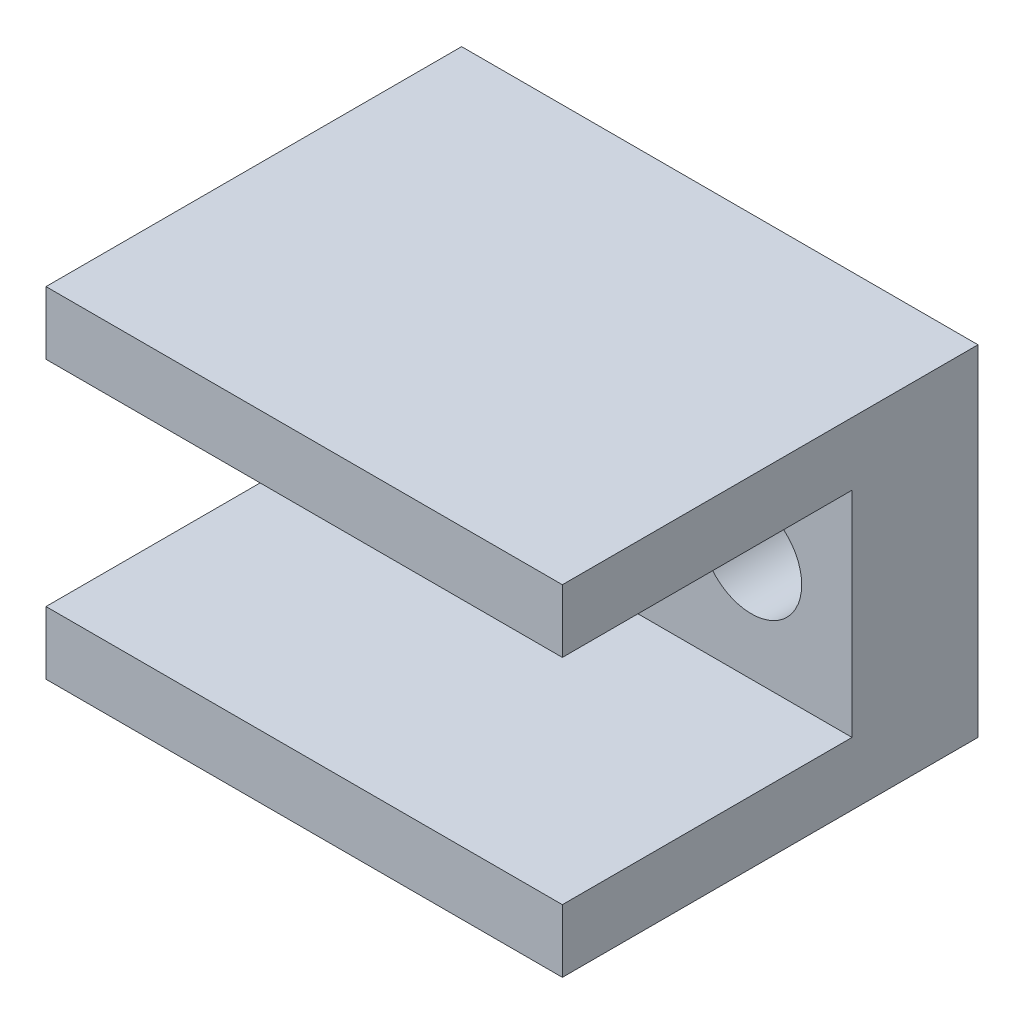
from build123d import *

# Parameters (mm, degrees)
SKETCH1_W           = 41
SKETCH1_H           = 27
BOSS_EXTRUDE1_DEPTH = 10
SKETCH2_W           = 41
SKETCH2_H           = 5
BOSS_EXTRUDE2_DEPTH = 23
CUT_EXTRUDE1_REACH  = 35.638
SKETCH3_R           = 4


with BuildPart() as part:
    # Sketch1 → Boss-Extrude1 (new body)
    with BuildSketch(Plane.XY):
        Rectangle(SKETCH1_W, SKETCH1_H)
    extrude(amount=BOSS_EXTRUDE1_DEPTH)

    # Sketch2 → Boss-Extrude2 (add)
    with BuildSketch(Plane.XY.offset(10)):
        with Locations((0, 11)):
            Rectangle(SKETCH2_W, SKETCH2_H)
        with Locations((0, -11)):
            Rectangle(SKETCH2_W, SKETCH2_H)
    extrude(amount=BOSS_EXTRUDE2_DEPTH)

    # Sketch3 → Cut-Extrude1 (cut, up to next)
    with BuildSketch(Plane.XY.offset(10), mode=Mode.PRIVATE) as cut_extrude1_sk1:
        with Locations((-12.5, 0)):
            Circle(SKETCH3_R)
    cut_extrude1_tool1 = extrude(cut_extrude1_sk1.sketch, amount=-CUT_EXTRUDE1_REACH, mode=Mode.PRIVATE) & part.part
    # Sketch3 → Cut-Extrude1 (cut, up to next)
    with BuildSketch(Plane.XY.offset(10), mode=Mode.PRIVATE) as cut_extrude1_sk2:
        with Locations((12.5, 0)):
            Circle(SKETCH3_R)
    cut_extrude1_tool2 = extrude(cut_extrude1_sk2.sketch, amount=-CUT_EXTRUDE1_REACH, mode=Mode.PRIVATE) & part.part
    add(cut_extrude1_tool1.solids().sort_by_distance((-12.5, 0, 10))[0], mode=Mode.SUBTRACT)
    add(cut_extrude1_tool2.solids().sort_by_distance((12.5, 0, 10))[0], mode=Mode.SUBTRACT)


solid = part.part
